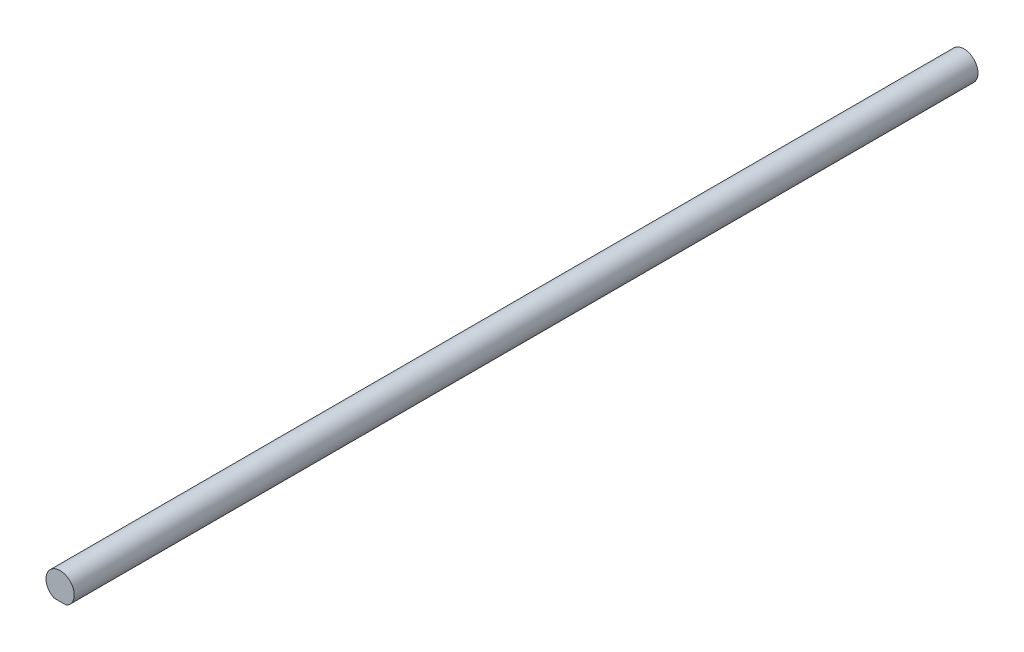
from build123d import *

# Parameters (mm, degrees)
BOSS_EXTRUDE1_DEPTH = 203.2


with BuildPart() as part:
    # Sketch1 → Boss-Extrude1 (new body)
    with BuildSketch(Plane.XY):
        with BuildLine():
            Line((-1.383950415, -2.8575), (1.383950415, -2.8575))
            ThreePointArc((1.383950415, -2.8575), (0, 3.175), (-1.383950415, -2.8575))
        make_face()
    extrude(amount=BOSS_EXTRUDE1_DEPTH)


solid = part.part
